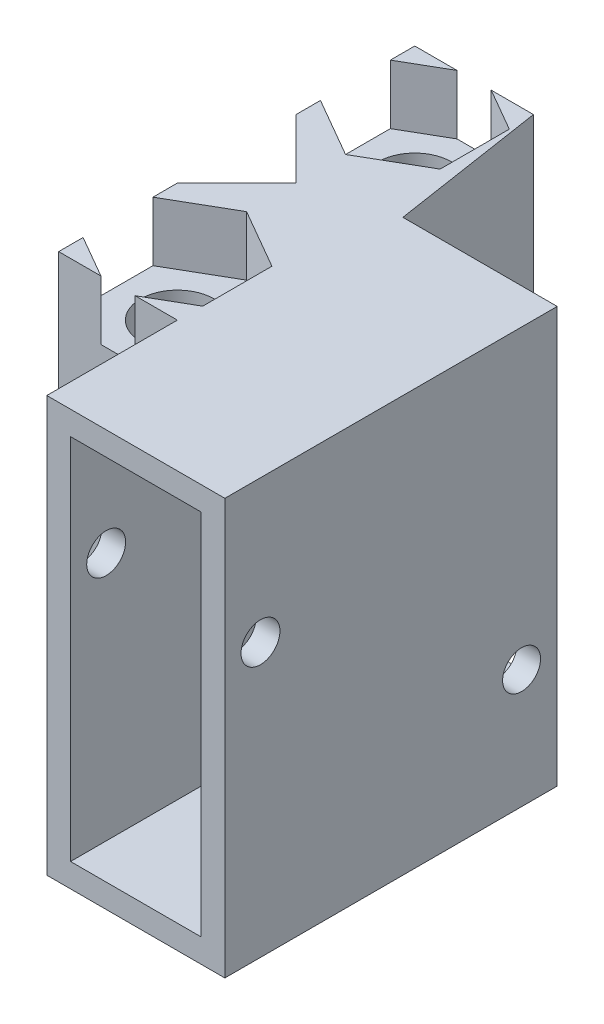
from build123d import *

# Parameters (mm, degrees)
ESQUISSE1_W             = 15
ESQUISSE1_H             = 35
ESQUISSE1_W_2           = 11
ESQUISSE1_H_2           = 31
EXTRU_MINCE1_DEPTH      = 28
ESQUISSE2_W             = 11
ESQUISSE2_H             = 5
BOSS_EXTRU_1_DEPTH      = 14
BOSS_EXTRU_2_REACH      = 48.669
ESQUISSE8_R             = 3.1
ESQUISSE3_R             = 1.6
ESQUISSE3_R_2           = 1.639162694
ENL_V_MAT_EXTRU_1_DEPTH = 50.979995998
ENL_V_MAT_EXTRU_2_DEPTH = 5


with BuildPart() as part:
    # Esquisse1 → Extru.-Mince1 (new body)
    with BuildSketch(Plane.XY):
        with Locations((5.5, 15.5)):
            Rectangle(ESQUISSE1_W, ESQUISSE1_H)
        with Locations((5.5, 15.5)):
            Rectangle(ESQUISSE1_W_2, ESQUISSE1_H_2, mode=Mode.SUBTRACT)
    extrude(amount=EXTRU_MINCE1_DEPTH)

    # Esquisse2 → Boss.-Extru.1 (add)
    with BuildSketch(Plane(origin=(0, 0, 0), x_dir=(-1, 0, 0), z_dir=(0, 0, -1))):
        with Locations((-5.5, 2.5)):
            Rectangle(ESQUISSE2_W, ESQUISSE2_H)
    extrude(amount=-BOSS_EXTRU_1_DEPTH)

    # Boss.-Extru.2: up to this face of the body (flat: up to its plane)
    boss_extru_2_end = Plane(part.part.faces().sort_by_distance((5.5, 33, 14))[0])
    # Esquisse8 → Boss.-Extru.2 (add, up to the picked face)
    with BuildSketch(Plane.XZ.offset(2), mode=Mode.PRIVATE) as boss_extru_2_sk1:
        Polygon((-2, 17), (-12, 17), (-12, 7), (-7, 2), (-12, -3), (-12, -13), (-2, -13), (0, 0), (-2, 0), align=None)
        with Locations(Location((-7, 12, 0), (0, 0, 270))):
            Circle(ESQUISSE8_R, mode=Mode.SUBTRACT)
        with Locations(Location((-7, -8, 0), (0, 0, 270))):
            Circle(ESQUISSE8_R, mode=Mode.SUBTRACT)
    boss_extru_2_tool1 = split(extrude(boss_extru_2_sk1.sketch, amount=-BOSS_EXTRU_2_REACH, mode=Mode.PRIVATE), bisect_by=boss_extru_2_end, keep=Keep.BOTH, mode=Mode.PRIVATE)
    add(boss_extru_2_tool1.solids().sort_by(Axis((-6.31025, -2, 1.638284), (0, 1, 0)))[0])

    # Esquisse3 → Enlèv. mat.-Extru.1 (cut, through all)
    with BuildSketch(Plane(origin=(13, 0, 0), x_dir=(0, 0, -1), z_dir=(1, 0, 0))):
        with Locations(Location((-3, 8, 0), (0, 0, 51.317812547))):
            Circle(ESQUISSE3_R)
        with Locations((-25, 21)):
            Circle(ESQUISSE3_R_2)
    extrude(amount=-ENL_V_MAT_EXTRU_1_DEPTH, mode=Mode.SUBTRACT)

    # Esquisse9 → Enlèv. mat.-Extru.2 (cut)
    with BuildSketch(Plane.XZ.offset(2)):
        Polygon((-7, -2.168762281), (-12.05, -5.084381141), (-12.05, -10.915618859), (-7, -13.831237719), (-1.95, -10.915618859), (-1.95, -5.084381141), align=None)
        Polygon((-1.95, 14.915618859), (-7, 17.831237719), (-12.05, 14.915618859), (-12.05, 9.084381141), (-7, 6.168762281), (-1.95, 9.084381141), align=None)
    enl_v_mat_extru_2 = extrude(amount=-ENL_V_MAT_EXTRU_2_DEPTH, mode=Mode.SUBTRACT)

    # Symétrie1: Enlèv. mat.-Extru.2 across plane
    add(enl_v_mat_extru_2.mirror(Plane(origin=(0, 15.5, 0), x_dir=(0, 0, 1), z_dir=(0, -1, 0))), mode=Mode.SUBTRACT)


solid = part.part
